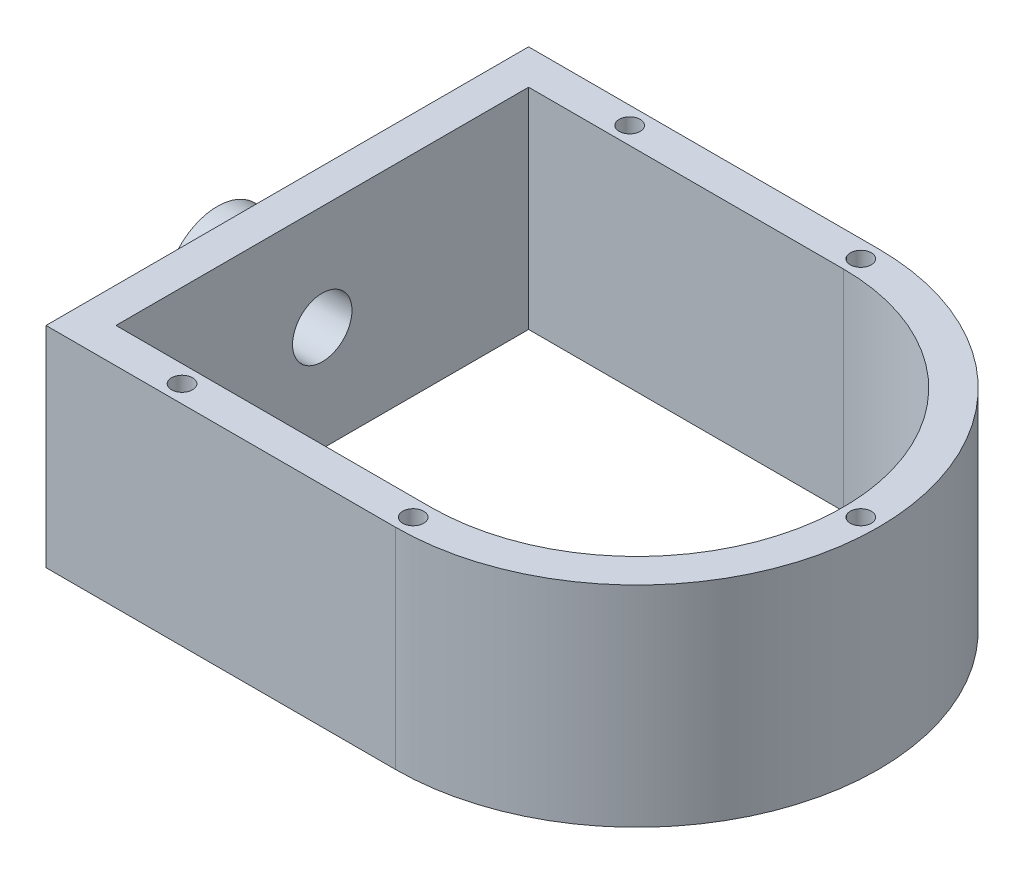
from build123d import *

# Parameters (mm, degrees)
SKETCH1_R           = 1.5
BOSS_EXTRUDE1_DEPTH = 30
SKETCH1_4_R         = 2.5
BOSS_EXTRUDE2_DEPTH = 3
SKETCH2_R           = 4.25
CUT_EXTRUDE1_DEPTH  = 3
BOSS_EXTRUDE3_START = 10
SKETCH3_R           = 7.5
SKETCH3_R_2         = 4.25
BOSS_EXTRUDE3_DEPTH = 10
FILLET1_R           = 5
SKETCH4_R           = 4.25
CUT_EXTRUDE2_DEPTH  = 10


with BuildPart() as part:
    # Sketch1 → Boss-Extrude1 (new body)
    with BuildSketch(Plane(origin=(0, 0, 0), x_dir=(1, 0, 0), z_dir=(0, 1, 0))):
        with BuildLine():
            Line((-40, -34.5), (10, -34.5))
            ThreePointArc((10, -34.5), (44.5, 0), (10, 34.5))
            Line((10, 34.5), (-40, 34.5))
            Line((-40, 34.5), (-40, -34.5))
        make_face()
        with Locations((-23.050007367, -32)):
            Circle(SKETCH1_R, mode=Mode.SUBTRACT)
        with Locations((10, -32)):
            Circle(SKETCH1_R, mode=Mode.SUBTRACT)
        with BuildLine():
            ThreePointArc((10, 29.5), (20.736274283, 27.476943326), (30, 21.685248442))
            ThreePointArc((30, 21.685248442), (39.5, 0), (30, -21.685248442))
            ThreePointArc((30, -21.685248442), (20.736274283, -27.476943326), (10, -29.5))
            Line((10, -29.5), (-35, -29.5))
            Line((-35, -29.5), (-35, 29.5))
            Line((-35, 29.5), (10, 29.5))
        make_face(mode=Mode.SUBTRACT)
        with Locations((-23.050007367, 32)):
            Circle(SKETCH1_R, mode=Mode.SUBTRACT)
        with Locations((42, 0)):
            Circle(SKETCH1_R, mode=Mode.SUBTRACT)
        with Locations((10, 32)):
            Circle(SKETCH1_R, mode=Mode.SUBTRACT)
    extrude(amount=BOSS_EXTRUDE1_DEPTH)

    # Sketch1<4> → Boss-Extrude2 (add)
    with BuildSketch(Plane(origin=(0, 0, 0), x_dir=(1, 0, 0), z_dir=(0, 1, 0))):
        with BuildLine():
            ThreePointArc((30, -21.685248442), (39.5, 0), (30, 21.685248442))
            Line((30, 21.685248442), (30, 18.020023033))
            Line((30, 18.020023033), (30, -9.598736105))
            Line((30, -9.598736105), (30, -21.685248442))
        make_face()
        with Locations((35, 0)):
            Circle(SKETCH1_4_R, mode=Mode.SUBTRACT)
    extrude(amount=BOSS_EXTRUDE2_DEPTH)

    # Sketch2 → Cut-Extrude1 (cut)
    with BuildSketch(Plane.ZY.offset(40)):
        with Locations((0, 15)):
            Circle(SKETCH2_R)
    extrude(amount=-CUT_EXTRUDE1_DEPTH, mode=Mode.SUBTRACT)

    # Sketch3 → Boss-Extrude3 (add)
    with BuildSketch(Plane.ZY.offset(40).offset(BOSS_EXTRUDE3_START)):
        with Locations((0, 15)):
            Circle(SKETCH3_R)
        with Locations((0, 15)):
            Circle(SKETCH3_R_2, mode=Mode.SUBTRACT)
    extrude(amount=-BOSS_EXTRUDE3_DEPTH)

    # Fillet1
    fillet1_edges = [part.edges().sort_by_distance(p)[0] for p in [
        (-40, 15, -7.5),
    ]]
    fillet(fillet1_edges, radius=FILLET1_R)

    # Sketch4 → Cut-Extrude2 (cut)
    with BuildSketch(Plane.ZY.offset(37)):
        with Locations((0, 15)):
            Circle(SKETCH4_R)
    extrude(amount=-CUT_EXTRUDE2_DEPTH, mode=Mode.SUBTRACT)


solid = part.part
